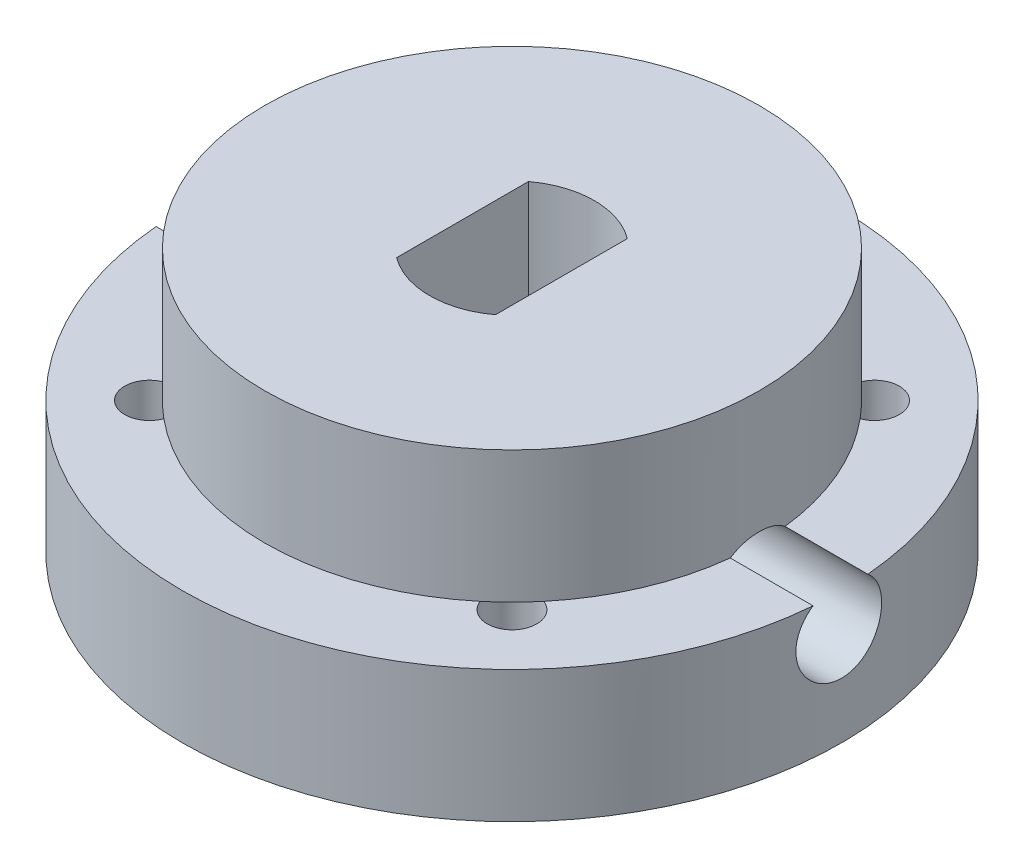
from build123d import *

# Parameters (mm, degrees)
SKETCH_1_R               = 10
EXTRUDE_1_DEPTH          = 8
CUT_EXTRUDE_START        = -4
SKETCH_2_R               = 10
SKETCH_2_R_2             = 7.5
CUT_EXTRUDE_1_DEPTH      = 4
CUT_EXTRUDE_2_DEPTH      = 18.211914478
CUT_EXTRUDE_2_DEPTH_BACK = 18.211914478
SKETCH_3_R               = 1.3
SKETCH_4_R               = 0.75
CUT_EXTRUDE_3_DEPTH      = 4


with BuildPart() as part:
    # 草图1 → 凸台-拉伸1 (new body)
    with BuildSketch(Plane(origin=(0, 0, 0), x_dir=(1, 0, 0), z_dir=(0, 1, 0))):
        with Locations(Location((0, 0, 0), (0, 0, 270))):
            Circle(SKETCH_1_R)
        with BuildLine():
            Line((-1.5, 2), (-1.5, -2))
            ThreePointArc((-1.5, -2), (0, -2.5), (1.5, -2))
            Line((1.5, -2), (1.5, 2))
            ThreePointArc((1.5, 2), (0, 2.5), (-1.5, 2))
        make_face(mode=Mode.SUBTRACT)
    extrude(amount=EXTRUDE_1_DEPTH)

    # 草图2 → 切除-拉伸1 (cut)
    with BuildSketch(Plane(origin=(0, 8, 0), x_dir=(1, 0, 0), z_dir=(0, 1, 0)).offset(CUT_EXTRUDE_START)):
        with Locations(Location((0, 0, 0), (0, 0, 270))):
            Circle(SKETCH_2_R)
        with Locations(Location((0, 0, 0), (0, 0, 270))):
            Circle(SKETCH_2_R_2, mode=Mode.SUBTRACT)
    extrude(amount=CUT_EXTRUDE_1_DEPTH, mode=Mode.SUBTRACT)

    # 草图3 → 切除-拉伸2 (cut, two sides: drawn at the far end of the back side and taken through both)
    with BuildSketch(Plane(origin=(-1.5, 0, 0), x_dir=(0, 0, -1), z_dir=(1, 0, 0)).offset(-CUT_EXTRUDE_2_DEPTH_BACK)):
        with Locations(Location((0, 3, 0), (0, 0, 309.715229307))):
            Circle(SKETCH_3_R)
    extrude(amount=CUT_EXTRUDE_2_DEPTH + CUT_EXTRUDE_2_DEPTH_BACK, mode=Mode.SUBTRACT)

    # 草图4 → 切除-拉伸3 (cut)
    with BuildSketch(Plane(origin=(0, 4, 0), x_dir=(1, 0, 0), z_dir=(0, 1, 0))):
        with Locations(Location((-5.5, 5.5, 0), (0, 0, 270))):
            Circle(SKETCH_4_R)
        with Locations(Location((5.5, 5.5, 0), (0, 0, 270))):
            Circle(SKETCH_4_R)
        with Locations(Location((-5.5, -5.5, 0), (0, 0, 270))):
            Circle(SKETCH_4_R)
        with Locations(Location((5.5, -5.5, 0), (0, 0, 270))):
            Circle(SKETCH_4_R)
    extrude(amount=-CUT_EXTRUDE_3_DEPTH, mode=Mode.SUBTRACT)


solid = part.part
